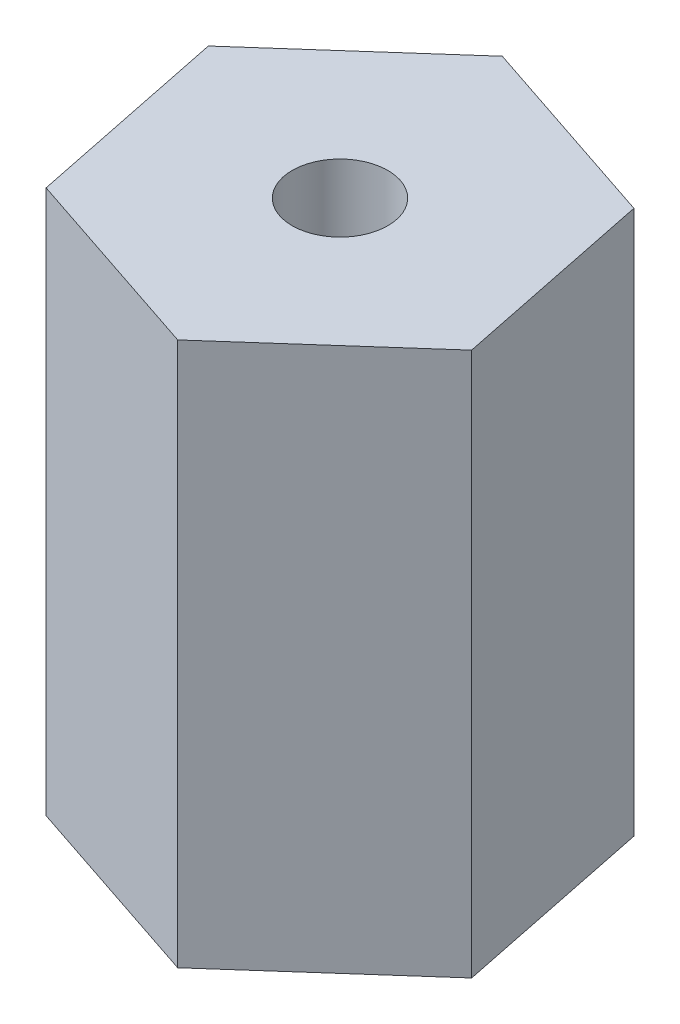
from build123d import *

# Parameters (mm, degrees)
BOSS_EXTRUDE1_DEPTH = 18.000000068
SKETCH2_R           = 1.585000005
CUT_EXTRUDE1_DEPTH  = 21.306358097


with BuildPart() as part:
    # Sketch1 → Boss-Extrude1 (new body)
    with BuildSketch(Plane(origin=(0, 0, 0), x_dir=(1, 0, 0), z_dir=(0, 1, 0))):
        Polygon((5.158081931, 4.571594046), (-1.380075614, 6.75282701), (-6.538157546, 2.181232964), (-5.158081931, -4.571594046), (1.380075614, -6.75282701), (6.538157546, -2.181232964), align=None)
    extrude(amount=BOSS_EXTRUDE1_DEPTH)

    # Sketch2 → Cut-Extrude1 (cut, through all)
    with BuildSketch(Plane(origin=(0, 18.000000068, 0), x_dir=(1, 0, 0), z_dir=(0, 1, 0))):
        with Locations(Location((0, 0, 0), (0, 0, 270))):
            Circle(SKETCH2_R)
    extrude(amount=-CUT_EXTRUDE1_DEPTH, mode=Mode.SUBTRACT)


solid = part.part
